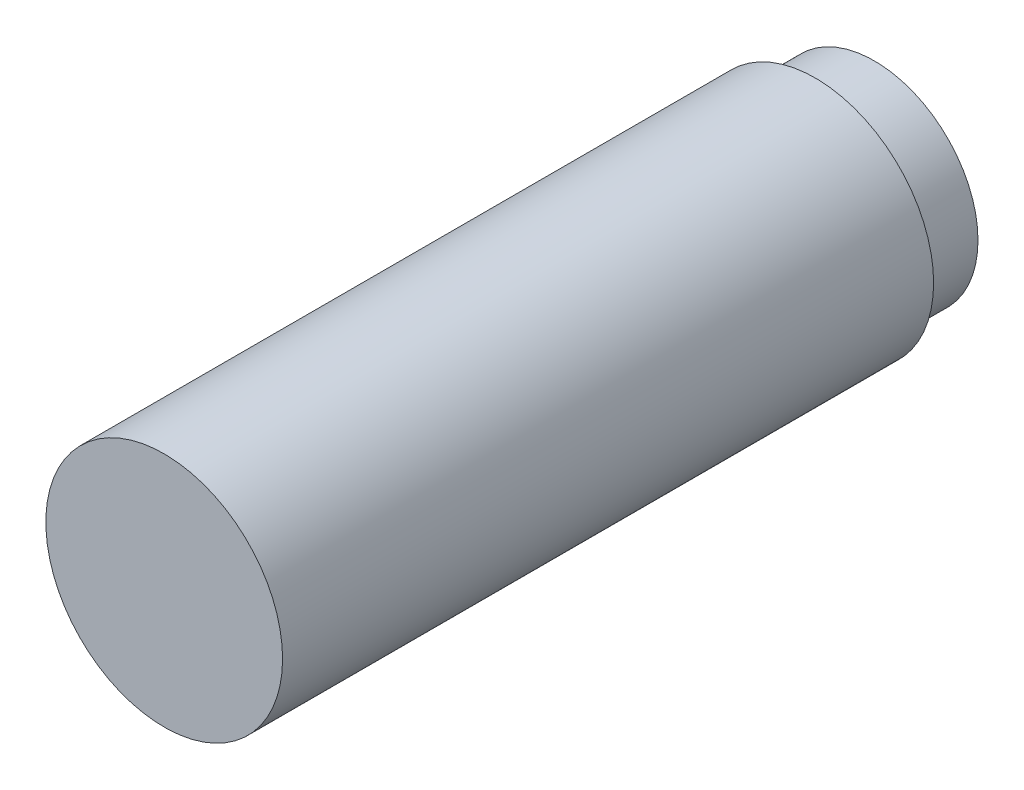
from build123d import *

# Parameters (mm, degrees)
BOSS_EXTRUDE2_START = 76.2
SKETCH1_R           = 25.4
BOSS_EXTRUDE2_DEPTH = 152.4
CUT_EXTRUDE1_START  = -12.7
SKETCH2_R           = 25.4
SKETCH2_R_2         = 22.225
CUT_EXTRUDE1_DEPTH  = 12.7


with BuildPart() as part:
    # Sketch1 → Boss-Extrude2 (new body)
    with BuildSketch(Plane.XY.offset(BOSS_EXTRUDE2_START)):
        Circle(SKETCH1_R)
    extrude(amount=-BOSS_EXTRUDE2_DEPTH)

    # Sketch2 → Cut-Extrude1 (cut)
    with BuildSketch(Plane(origin=(0, 0, -76.2), x_dir=(-1, 0, 0), z_dir=(0, 0, -1)).offset(CUT_EXTRUDE1_START)):
        with Locations(Location((0, 0, 0), (0, 0, 180))):
            Circle(SKETCH2_R)
        Circle(SKETCH2_R_2, mode=Mode.SUBTRACT)
    extrude(amount=CUT_EXTRUDE1_DEPTH, mode=Mode.SUBTRACT)


solid = part.part
